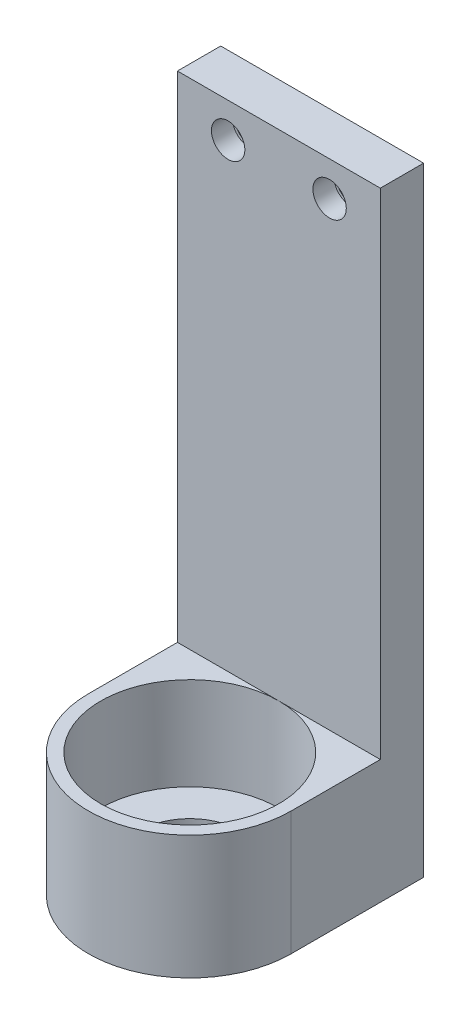
from build123d import *

# Parameters (mm, degrees)
SKETCH1_R                      = 8.1
BOSS_EXTRUDE1_DEPTH            = 100
SKETCH2_R                      = 14.4
CUT_EXTRUDE1_DEPTH             = 80
CUT_EXTRUDE2_START             = -80
CUT_EXTRUDE2_DEPTH             = 80
SKETCH4_R                      = 14.4
CUT_EXTRUDE3_DEPTH             = 15
CBORE_FOR_M4_SHCS1_D           = 4.5
CBORE_FOR_M4_SHCS1_CBORE_D     = 5.4
CBORE_FOR_M4_SHCS1_CBORE_DEPTH = 3.4


with BuildPart() as part:
    # Sketch1 → Boss-Extrude1 (new body)
    with BuildSketch(Plane(origin=(0, 0, 0), x_dir=(1, 0, 0), z_dir=(0, 1, 0))):
        with BuildLine():
            Line((-16.4, 0), (-16.4, 21.4))
            Line((-16.4, 21.4), (16.4, 21.4))
            Line((16.4, 21.4), (16.4, 0))
            ThreePointArc((16.4, 0), (0, -16.4), (-16.4, 0))
        make_face()
        with Locations(Location((0, 0, 0), (0, 0, 270))):
            Circle(SKETCH1_R, mode=Mode.SUBTRACT)
    extrude(amount=BOSS_EXTRUDE1_DEPTH)

    # Sketch2 → Cut-Extrude1 (cut)
    with BuildSketch(Plane(origin=(0, 100, 0), x_dir=(1, 0, 0), z_dir=(0, 1, 0))):
        with Locations(Location((0, 0, 0), (0, 0, 270))):
            Circle(SKETCH2_R)
    extrude(amount=-CUT_EXTRUDE1_DEPTH, mode=Mode.SUBTRACT)

    # Sketch3 → Cut-Extrude2 (cut)
    with BuildSketch(Plane(origin=(0, 100, 0), x_dir=(1, 0, 0), z_dir=(0, 1, 0)).offset(CUT_EXTRUDE2_START)):
        with BuildLine():
            Line((-16.4, 0), (-16.4, 14.4))
            Line((-16.4, 14.4), (16.4, 14.4))
            Line((16.4, 14.4), (16.4, 0))
            ThreePointArc((16.4, 0), (0, -16.4), (-16.4, 0))
        make_face()
    extrude(amount=CUT_EXTRUDE2_DEPTH, mode=Mode.SUBTRACT)

    # Sketch4 → Cut-Extrude3 (cut)
    with BuildSketch(Plane(origin=(0, 20, 0), x_dir=(1, 0, 0), z_dir=(0, 1, 0))):
        with Locations(Location((0, 0, 0), (0, 0, 270))):
            Circle(SKETCH4_R)
    extrude(amount=-CUT_EXTRUDE3_DEPTH, mode=Mode.SUBTRACT)

    # CBORE for M4 SHCS1 (through all)
    with Locations(Plane.XY.offset(-14.4)):
        with Locations((8.2, 94.410911653), (-8.2, 94.410911653)):
            CounterBoreHole(CBORE_FOR_M4_SHCS1_D / 2, CBORE_FOR_M4_SHCS1_CBORE_D / 2, CBORE_FOR_M4_SHCS1_CBORE_DEPTH)


solid = part.part
